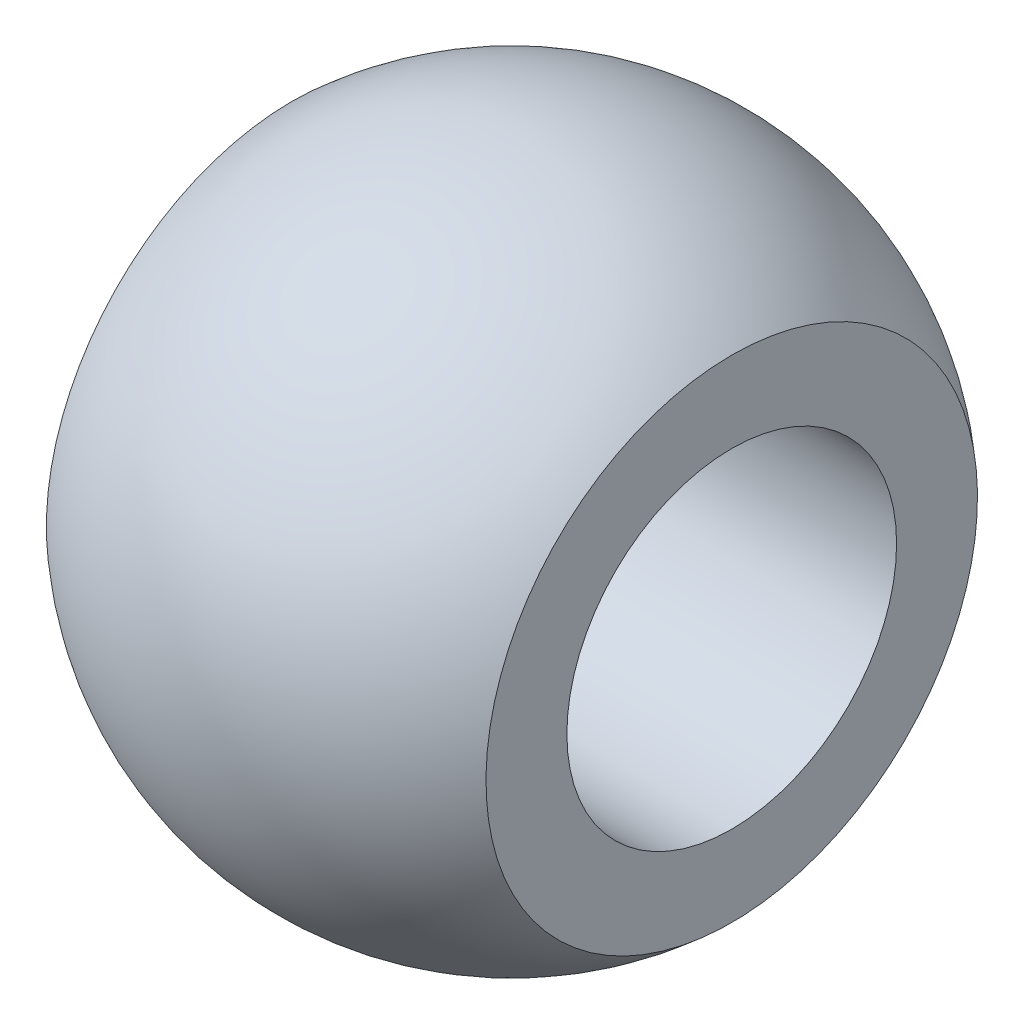
from build123d import *

# Parameters (mm, degrees)
SKETCH2_OUTSIDE_W   = 34.314
SKETCH2_OUTSIDE_H   = 34.314
SKETCH2_OUTSIDE_W_2 = 16
SKETCH2_OUTSIDE_H_2 = 32.405240589
CUT_EXTRUDE1_DEPTH  = 20
SKETCH3_R           = 6
CUT_EXTRUDE2_DEPTH  = 40


with BuildPart() as part:
    # Sketch1 → Revolve1 (revolve)
    with BuildSketch(Plane.XY):
        with BuildLine():
            Line((0, 12), (0, -12))
            ThreePointArc((0, -12), (-12, 0), (0, 12))
        make_face()
    revolve(axis=Axis((0, 16.812644527, 0), (0, -1, 0)))

    # Sketch2 outside → Cut-Extrude1 (cut, symmetric)
    with BuildSketch(Plane.XY):
        Rectangle(SKETCH2_OUTSIDE_W, SKETCH2_OUTSIDE_H)
        with Locations((0, -1.599752384)):
            Rectangle(SKETCH2_OUTSIDE_W_2, SKETCH2_OUTSIDE_H_2, mode=Mode.SUBTRACT)
    extrude(amount=CUT_EXTRUDE1_DEPTH, both=True, mode=Mode.SUBTRACT)

    # Sketch3 → Cut-Extrude2 (cut)
    with BuildSketch(Plane.ZY.offset(8)):
        with Locations(Location((0, 0, 0), (0, 0, 270))):
            Circle(SKETCH3_R)
    extrude(amount=-CUT_EXTRUDE2_DEPTH, mode=Mode.SUBTRACT)


solid = part.part
